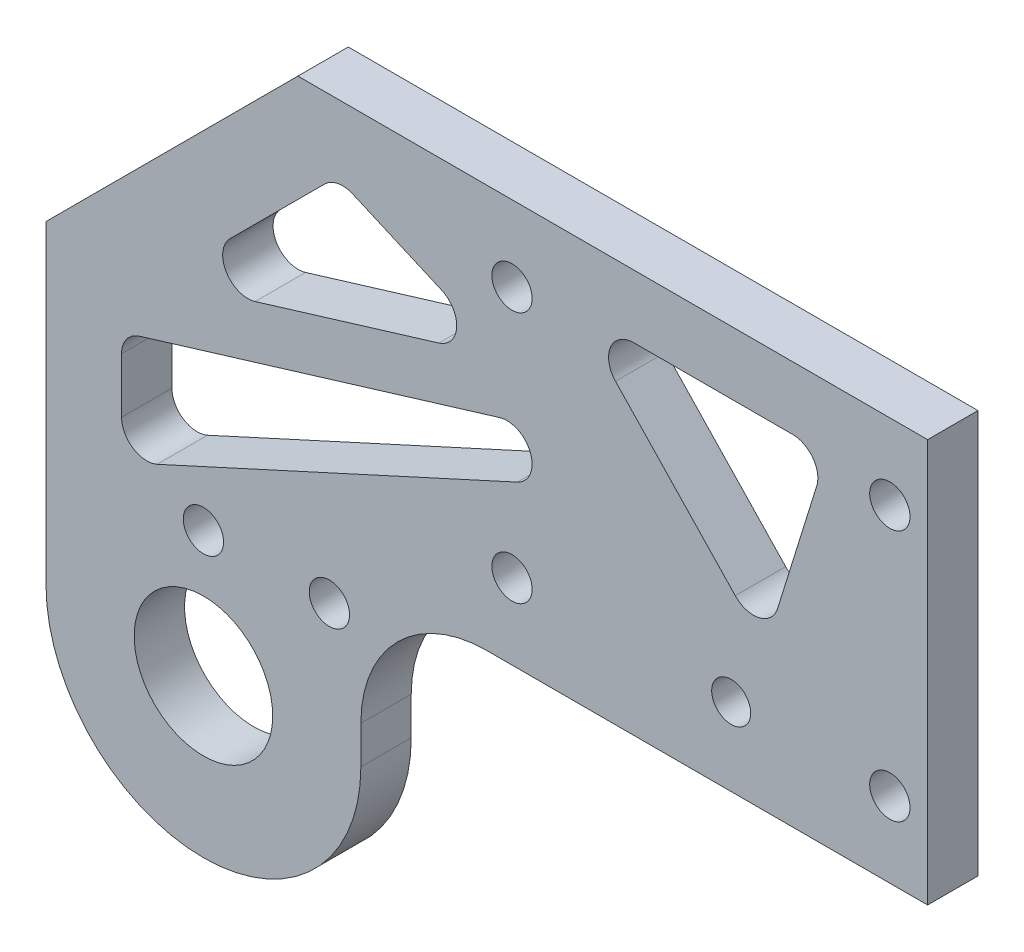
from build123d import *

# Parameters (mm, degrees)
SKETCH_1_R          = 1.6
SKETCH_1_R_2        = 6.075
EXTRUDE_1_DEPTH     = 4
CUT_EXTRUDE_1_REACH = 75.125
SKETCH_2_R          = 1.6
CUT_EXTRUDE_2_REACH = 75.125
SKETCH_3_R          = 1.6
CUT_EXTRUDE_3_REACH = 75.125
SKETCH_4_R          = 1.55
EXTRUDE_START       = -4
SKETCH_5_R          = 6.075
SKETCH_5_R_2        = 5.5
EXTRUDE_2_DEPTH     = 4
CHAMFER_1_SIZE      = 20
CUT_EXTRUDE_4_DEPTH = 10


with BuildPart() as part:
    # 草图1 → 凸台-拉伸1 (new body)
    with BuildSketch(Plane(origin=(0, 0, 0), x_dir=(-1, 0, 0), z_dir=(0, 0, -1))):
        with BuildLine():
            Line((12.5, 0), (12.5, 15))
            Line((12.5, 15), (12.5, 45))
            Line((12.5, 45), (-17.5, 45))
            Line((-17.5, 45), (-57.5, 45))
            Line((-57.5, 45), (-57.5, 13))
            Line((-57.5, 13), (-22.5, 13))
            ThreePointArc((-22.5, 13), (-15.428932188, 10.071067812), (-12.5, 3))
            Line((-12.5, 3), (-12.5, 0))
            ThreePointArc((-12.5, 0), (0, -12.5), (12.5, 0))
        make_face()
        with Locations(Location((-54.5, 19, 0), (0, 0, 180))):
            Circle(SKETCH_1_R, mode=Mode.SUBTRACT)
        with Locations(Location((-24.5, 19, 0), (0, 0, 180))):
            Circle(SKETCH_1_R, mode=Mode.SUBTRACT)
        with Locations(Location((-24.5, 39, 0), (0, 0, 180))):
            Circle(SKETCH_1_R, mode=Mode.SUBTRACT)
        with Locations(Location((-54.5, 39, 0), (0, 0, 180))):
            Circle(SKETCH_1_R, mode=Mode.SUBTRACT)
        with Locations(Location((0, 0, 0), (0, 0, 180))):
            Circle(SKETCH_1_R_2, mode=Mode.SUBTRACT)
    extrude(amount=-EXTRUDE_1_DEPTH)

    # 草图2 → 切除-拉伸1 (cut, up to next)
    with BuildSketch(Plane(origin=(0, 0, 0), x_dir=(-1, 0, 0), z_dir=(0, 0, -1)), mode=Mode.PRIVATE) as cut_extrude_1_sk1:
        with Locations((0, 10)):
            Circle(SKETCH_2_R)
    cut_extrude_1_tool1 = extrude(cut_extrude_1_sk1.sketch, amount=-CUT_EXTRUDE_1_REACH, mode=Mode.PRIVATE) & part.part
    add(cut_extrude_1_tool1.solids().sort_by_distance((0, 10, 0))[0], mode=Mode.SUBTRACT)

    # 草图3 → 切除-拉伸2 (cut, up to next)
    with BuildSketch(Plane.XY.offset(4), mode=Mode.PRIVATE) as cut_extrude_2_sk1:
        with Locations((10, 10)):
            Circle(SKETCH_3_R)
    cut_extrude_2_tool1 = extrude(cut_extrude_2_sk1.sketch, amount=-CUT_EXTRUDE_2_REACH, mode=Mode.PRIVATE) & part.part
    add(cut_extrude_2_tool1.solids().sort_by_distance((10, 10, 4))[0], mode=Mode.SUBTRACT)

    # 草图4 → 切除-拉伸3 (cut, up to next)
    with BuildSketch(Plane.XY.offset(4), mode=Mode.PRIVATE) as cut_extrude_3_sk1:
        with Locations((41.903612375, 19.168270074)):
            Circle(SKETCH_4_R)
    cut_extrude_3_tool1 = extrude(cut_extrude_3_sk1.sketch, amount=-CUT_EXTRUDE_3_REACH, mode=Mode.PRIVATE) & part.part
    add(cut_extrude_3_tool1.solids().sort_by_distance((41.903612, 19.16827, 4))[0], mode=Mode.SUBTRACT)

    # 草图5 → 凸台-拉伸2 (add)
    with BuildSketch(Plane.XY.offset(4).offset(EXTRUDE_START)):
        Circle(SKETCH_5_R)
        Circle(SKETCH_5_R_2, mode=Mode.SUBTRACT)
    extrude(amount=EXTRUDE_2_DEPTH)

    # 倒角1
    chamfer_1_edges = [part.edges().sort_by_distance(p)[0] for p in [
        (-12.5, 45, 2),
    ]]
    chamfer(chamfer_1_edges, length=CHAMFER_1_SIZE)

    # 草图6 → 切除-拉伸4 (cut)
    with BuildSketch(Plane.XY.offset(4)):
        with BuildLine():
            Line((9.634482471, 38.649201097), (2.113604897, 31.128323523))
            ThreePointArc((2.113604897, 31.128323523), (1.812829409, 28.685123781), (4.110129794, 27.800758579))
            Line((4.110129794, 27.800758579), (18.692042435, 32.238632926))
            ThreePointArc((18.692042435, 32.238632926), (20.106354196, 34.035811099), (18.910017796, 35.984889435))
            Line((18.910017796, 35.984889435), (11.848982729, 39.067892662))
            ThreePointArc((11.848982729, 39.067892662), (10.677142261, 39.200171443), (9.634482471, 38.649201097))
        make_face()
        with BuildLine():
            Line((32.71747005, 36.620860129), (42.227284145, 26.633201667))
            ThreePointArc((42.227284145, 26.633201667), (44.130956278, 26.064840044), (45.58542604, 27.418176749))
            Line((45.58542604, 27.418176749), (48.692879305, 37.405835211))
            ThreePointArc((48.692879305, 37.405835211), (48.393816721, 39.185679219), (46.783175609, 40))
            Line((46.783175609, 40), (34.165908249, 40))
            ThreePointArc((34.165908249, 40), (32.327664557, 38.787946781), (32.71747005, 36.620860129))
        make_face()
        with BuildLine():
            Line((-6.5, 18.908624945), (-6.5, 14.540152244))
            ThreePointArc((-6.5, 14.540152244), (-5.580990037, 12.857457816), (-3.668539461, 12.721176331))
            Line((-3.668539461, 12.721176331), (24.927936602, 25.79273008))
            ThreePointArc((24.927936602, 25.79273008), (25.966793038, 28.320165173), (23.514164728, 29.525057374))
            Line((23.514164728, 29.525057374), (-5.082311335, 20.821976327))
            ThreePointArc((-5.082311335, 20.821976327), (-6.106957166, 20.099292264), (-6.5, 18.908624945))
        make_face()
    extrude(amount=-CUT_EXTRUDE_4_DEPTH, mode=Mode.SUBTRACT)


solid = part.part
